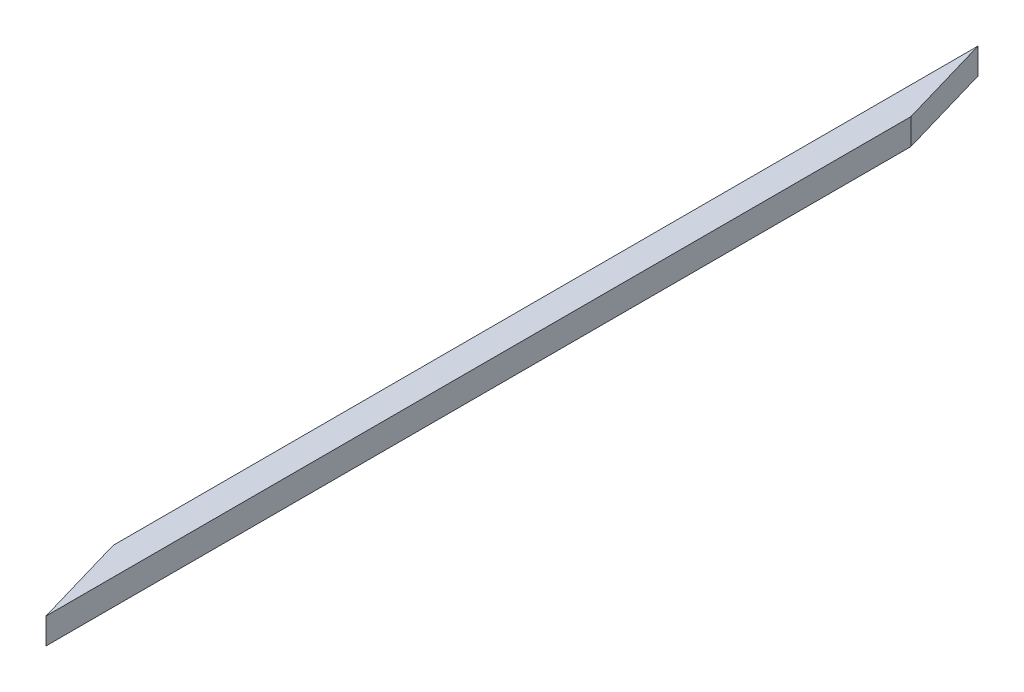
from build123d import *

# Parameters (mm, degrees)
SKETCH1_W           = 50
SKETCH1_H           = 47
BOSS_EXTRUDE1_DEPTH = 1737.37
CUT_EXTRUDE1_DEPTH  = 50


with BuildPart() as part:
    # Sketch1 → Boss-Extrude1 (new body)
    with BuildSketch(Plane.XY):
        with Locations((-7.02247191, 4.028089888)):
            Rectangle(SKETCH1_W, SKETCH1_H)
    extrude(amount=BOSS_EXTRUDE1_DEPTH)

    # Sketch2 → Cut-Extrude1 (cut)
    with BuildSketch(Plane(origin=(0, 27.528089888, 0), x_dir=(1, 0, 0), z_dir=(0, 1, 0))):
        Polygon((17.97752809, 0), (-32.02247191, 0), (17.97752809, -171.610372539), align=None)
        Polygon((17.97752809, -1737.37), (-32.02247191, -1565.814652395), (-32.02247191, -1737.37), align=None)
    extrude(amount=-CUT_EXTRUDE1_DEPTH, mode=Mode.SUBTRACT)


solid = part.part
